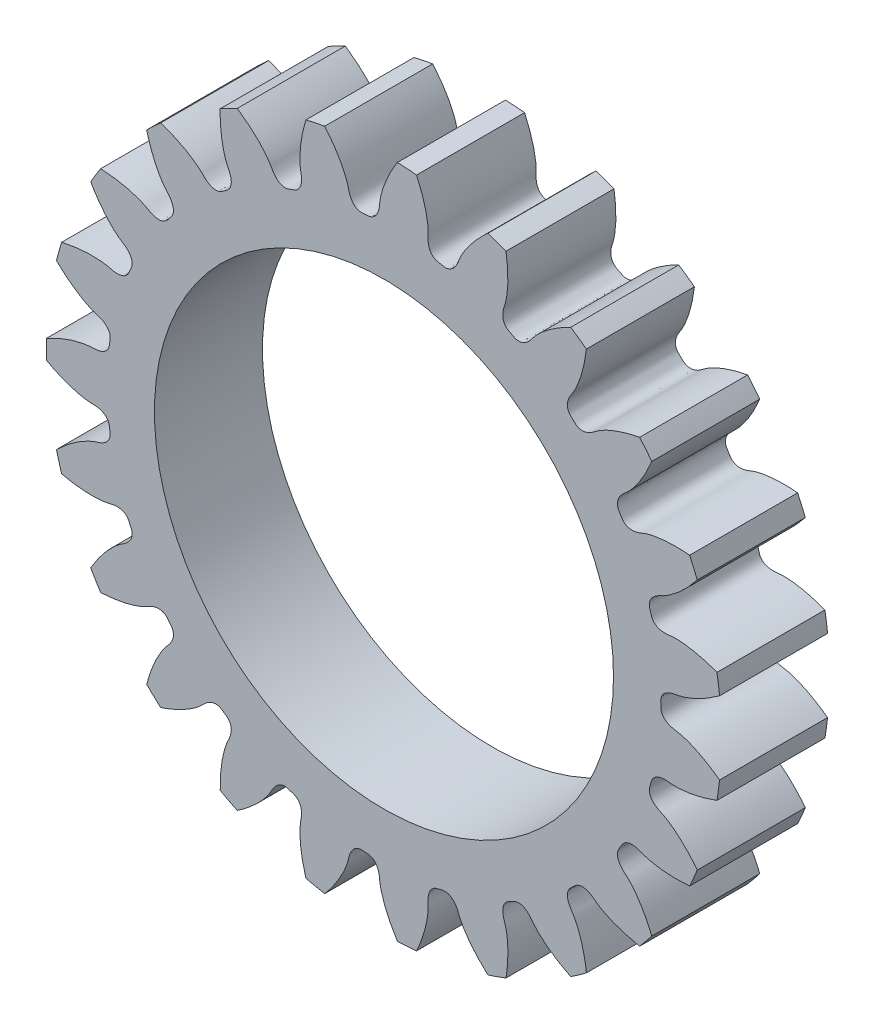
from build123d import *

# Parameters (mm, degrees)
SKETCHREVOLVESPURGEAR_W       = 4
SKETCHREVOLVESPURGEAR_H       = 12.499999812
TOOTHEXTRUDECUTSPURGEAR_DEPTH = 2
PATTERNSPURGEAR_COUNT         = 23
BOREREVOLVESKETCH_W           = 4
BOREREVOLVESKETCH_H           = 8.5


with BuildPart() as part:
    # SketchRevolveSpurGear → SpurGear (revolve)
    with BuildSketch(Plane(origin=(0, 0, 0), x_dir=(0, 0, -1), z_dir=(1, 0, 0))):
        with Locations((0, 6.249999906)):
            Rectangle(SKETCHREVOLVESPURGEAR_W, SKETCHREVOLVESPURGEAR_H)
    revolve(axis=Axis((0, 0, 0), (0, 0, -1)))

    # SketchToothSpurGear → ToothExtrudeCutSpurGear (cut, symmetric)
    with BuildSketch(Plane.XY):
        with BuildLine():
            ThreePointArc((12.473470088, 1.383849427), (12.549999812, 0), (12.473470088, -1.383849427))
            add(Edge.make_bspline(
                [(12.473470088, -1.383849427), (12.378033707, -1.312216761), (12.23571324, -1.211473748), (12.045399906, -1.089349148), (11.912139879, -1.009284795), (11.784792452, -0.937797475), (11.663740712, -0.874464431), (11.549347824, -0.818847783), (11.441956477, -0.770495606), (11.341888383, -0.728942586), (11.249443769, -0.693711289), (11.164901026, -0.664311673), (11.088515981, -0.640246332), (11.020522507, -0.620997614), (10.961129106, -0.60607108), (10.910527801, -0.594868707), (10.814117406, -0.576796811), (10.715929012, -0.564205455), (10.618407774, -0.534806023), (10.569317662, -0.517080519), (10.521993409, -0.496321835), (10.476113003, -0.471984758), (10.431406913, -0.443087861), (10.387800551, -0.408233364), (10.345741813, -0.36552564), (10.306808002, -0.312782549), (10.27416318, -0.24840824), (10.254781608, -0.178054352), (10.24693594, -0.093861077), (10.251886608, 0), (10.24693594, 0.093861077), (10.254781608, 0.178054352), (10.27416318, 0.24840824), (10.306808002, 0.312782549), (10.345741813, 0.36552564), (10.387800551, 0.408233364), (10.431406913, 0.443087861), (10.476113003, 0.471984758), (10.521993409, 0.496321835), (10.569317662, 0.517080519), (10.618407774, 0.534806023), (10.715929012, 0.564205455), (10.814117406, 0.576796811), (10.910527801, 0.594868707), (10.961129106, 0.60607108), (11.020522507, 0.620997614), (11.088515981, 0.640246332), (11.164901026, 0.664311673), (11.249443769, 0.693711289), (11.341888383, 0.728942586), (11.441956477, 0.770495606), (11.549347824, 0.818847783), (11.663740712, 0.874464431), (11.784792452, 0.937797475), (11.912139879, 1.009284795), (12.045399906, 1.089349148), (12.23571324, 1.211473748), (12.378033707, 1.312216761), (12.473470088, 1.383849427)],
                knots=[0, 0, 0, 0, 0.064534055, 0.094253685, 0.122275051, 0.148598153, 0.17322299, 0.196149562, 0.21737787, 0.236907913, 0.254739692, 0.270873206, 0.285308455, 0.29804544, 0.309084161, 0.318424617, 0.326066809, 0.362140551, 0.371723882, 0.381093404, 0.390354768, 0.399646994, 0.409151991, 0.419102388, 0.429778972, 0.441478238, 0.454420734, 0.468592095, 0.480658926, 0.5, 0.519341074, 0.531407905, 0.545579266, 0.558521762, 0.570221028, 0.580897612, 0.590848009, 0.600353006, 0.609645232, 0.618906596, 0.628276118, 0.637859449, 0.673933191, 0.681575383, 0.690915839, 0.70195456, 0.714691545, 0.729126794, 0.745260308, 0.763092087, 0.78262213, 0.803850438, 0.82677701, 0.851401847, 0.877724949, 0.905746315, 0.935465945, 1, 1, 1, 1], degree=3))
        make_face()
    toothextrudecutspurgear = extrude(amount=TOOTHEXTRUDECUTSPURGEAR_DEPTH, both=True, mode=Mode.SUBTRACT)

    # PatternSpurGear: ToothExtrudeCutSpurGear ×23 about axis
    patternspurgear_axis = Axis((0, 0, 55), (0, 0, -1))
    for i in range(1, PATTERNSPURGEAR_COUNT):
        add(toothextrudecutspurgear.rotate(patternspurgear_axis, i * 360 / PATTERNSPURGEAR_COUNT), mode=Mode.SUBTRACT)

    # BoreRevolveSketch → BoreRevolveCut (revolve, cut)
    with BuildSketch(Plane(origin=(0, 0, 0), x_dir=(0, 0, -1), z_dir=(1, 0, 0))):
        with Locations((0, 4.25)):
            Rectangle(BOREREVOLVESKETCH_W, BOREREVOLVESKETCH_H)
    revolve(axis=Axis((0, 0, 0), (0, 0, -1)), mode=Mode.SUBTRACT)


solid = part.part
